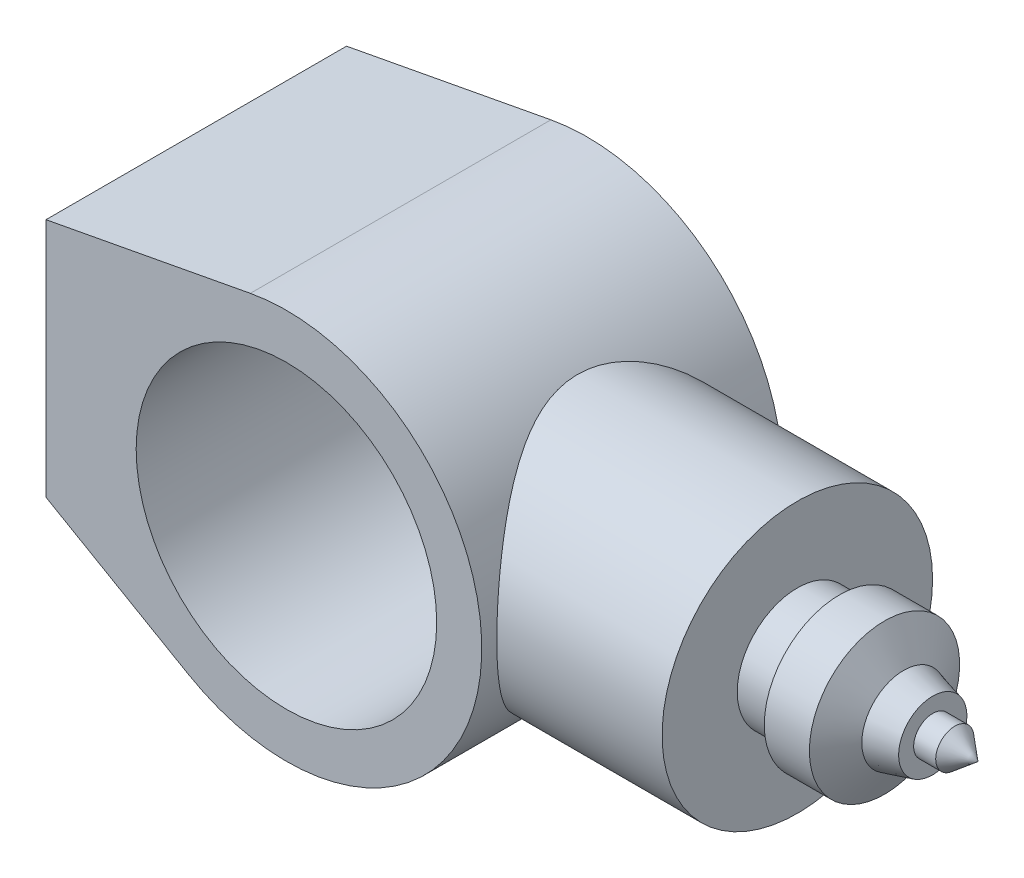
from build123d import *

# Parameters (mm, degrees)
IZIM1_R                          = 50
Y_KSEKLIK_EKSTR_ZYON1_DEPTH      = 50
Y_KSEKLIK_EKSTR_ZYON2_REACH      = 218.16
Y_KSEKLIK_EKSTR_ZYON2_END_RADIUS = 65
IZIM2_R                          = 45


with BuildPart() as part:
    # Çizim1 → Yükseklik-Ekstrüzyon1 (new, symmetric)
    with BuildSketch(Plane.XY):
        with BuildLine():
            Line((-80, -28.89070525), (-80, 51.10929475))
            Line((-80, 51.10929475), (-12, 63.882705015))
            ThreePointArc((-12, 63.882705015), (64.076421536, -10.918434095), (-32.479384713, -56.303548455))
            Line((-32.479384713, -56.303548455), (-80, -28.89070525))
        make_face()
        Circle(IZIM1_R, mode=Mode.SUBTRACT)
    extrude(amount=Y_KSEKLIK_EKSTR_ZYON1_DEPTH, both=True)

    # Yükseklik-Ekstrüzyon2: up to this cylinder (the profile starts outside it)
    y_kseklik_ekstr_zyon2_end = Plane(origin=(0, 0, 0), z_dir=(0, 0, -1)) * Cylinder(Y_KSEKLIK_EKSTR_ZYON2_END_RADIUS, 567.32, mode=Mode.PRIVATE)
    # Çizim2 → Yükseklik-Ekstrüzyon2 (add, up to the surface)
    with BuildSketch(Plane(origin=(120, 0, 0), x_dir=(0, 0, -1), z_dir=(1, 0, 0)), mode=Mode.PRIVATE) as y_kseklik_ekstr_zyon2_sk1:
        Circle(IZIM2_R)
    y_kseklik_ekstr_zyon2_tool1 = extrude(y_kseklik_ekstr_zyon2_sk1.sketch, amount=-Y_KSEKLIK_EKSTR_ZYON2_REACH, mode=Mode.PRIVATE) - y_kseklik_ekstr_zyon2_end
    add(y_kseklik_ekstr_zyon2_tool1.solids().sort_by_distance((120, 0, 0))[0])

    # Çizim3 → Döndür1 (revolve)
    with BuildSketch(Plane.XY, mode=Mode.PRIVATE) as d_nd_r1_sk:
        Polygon((164.385328123, -6.351150209), (172.385328123, -6.351150209), (180.109503873, 0), (120, 0), (120, -20), (134, -20), (134, -25), (149, -25), (155.385874648, -13.93934066), (165.04513291, -11.351150209), (165.04513291, -6.351150209), align=None)
    revolve(d_nd_r1_sk.sketch.rotate(Axis((0, 0, 0), (1, 0, 0)), 270), axis=Axis((0, 0, 0), (1, 0, 0)))


solid = part.part
